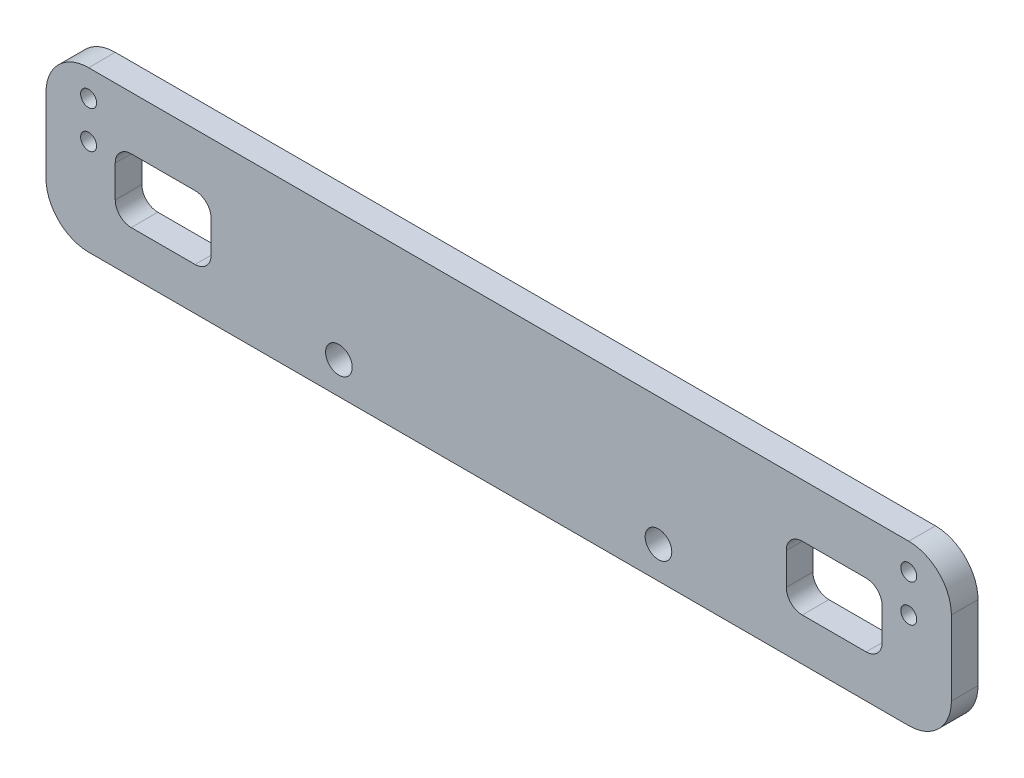
from build123d import *

# Parameters (mm, degrees)
SKETCH_1_W          = 170
SKETCH_1_H          = 60
SKETCH_1_R          = 1.5
EXTRUDE_1_DEPTH     = 5
SKETCH_2_R          = 2.5
CUT_EXTRUDE_1_DEPTH = 5
SKETCH_3_W          = 170
SKETCH_3_H          = 26
CUT_EXTRUDE_2_DEPTH = 10
SKETCH_4_W          = 18
SKETCH_4_H          = 12
CUT_EXTRUDE_3_DEPTH = 10
FILLET_1_R          = 3
SKETCH_5_W          = 170
SKETCH_5_H          = 4
CUT_EXTRUDE_4_DEPTH = 91.277350426
FILLET_2_R          = 8


with BuildPart() as part:
    # 草图1 → 凸台-拉伸1 (new body)
    with BuildSketch(Plane.XY):
        Rectangle(SKETCH_1_W, SKETCH_1_H)
        with Locations((-77, -8)):
            Circle(SKETCH_1_R, mode=Mode.SUBTRACT)
        with Locations((-77, -1)):
            Circle(SKETCH_1_R, mode=Mode.SUBTRACT)
        with Locations(Location((77, -1, 0), (0, 0, 180))):
            Circle(SKETCH_1_R, mode=Mode.SUBTRACT)
        with Locations(Location((77, -8, 0), (0, 0, 180))):
            Circle(SKETCH_1_R, mode=Mode.SUBTRACT)
    extrude(amount=EXTRUDE_1_DEPTH)

    # 草图2 → 切除-拉伸1 (cut)
    with BuildSketch(Plane.XY.offset(5)):
        with Locations((-30, -20)):
            Circle(SKETCH_2_R)
        with Locations((30, -20)):
            Circle(SKETCH_2_R)
    extrude(amount=-CUT_EXTRUDE_1_DEPTH, mode=Mode.SUBTRACT)

    # 草图3 → 切除-拉伸2 (cut)
    with BuildSketch(Plane.XY.offset(5)):
        with Locations((0, 17)):
            Rectangle(SKETCH_3_W, SKETCH_3_H)
    extrude(amount=-CUT_EXTRUDE_2_DEPTH, mode=Mode.SUBTRACT)

    # 草图4 → 切除-拉伸3 (cut)
    with BuildSketch(Plane.XY.offset(5)):
        with Locations((-63, -12)):
            Rectangle(SKETCH_4_W, SKETCH_4_H)
        with Locations((63, -12)):
            Rectangle(SKETCH_4_W, SKETCH_4_H)
    extrude(amount=-CUT_EXTRUDE_3_DEPTH, mode=Mode.SUBTRACT)

    # 圆角1
    fillet_1_edges = [part.edges().sort_by_distance(p)[0] for p in [
        (-72, -18, 2.5),
        (-72, -6, 2.5),
        (-54, -6, 2.5),
        (-54, -18, 2.5),
        (72, -6, 2.5),
        (72, -18, 2.5),
        (54, -18, 2.5),
        (54, -6, 2.5),
    ]]
    fillet(fillet_1_edges, radius=FILLET_1_R)

    # 草图5 → 切除-拉伸4 (cut, through all)
    with BuildSketch(Plane.XY.offset(5)):
        with Locations((0, -28)):
            Rectangle(SKETCH_5_W, SKETCH_5_H)
    extrude(amount=-CUT_EXTRUDE_4_DEPTH, mode=Mode.SUBTRACT)

    # 圆角2
    fillet_2_edges = [part.edges().sort_by_distance(p)[0] for p in [
        (-85, -26, 2.5),
        (85, -26, 2.5),
        (-85, 4, 2.5),
        (85, 4, 2.5),
    ]]
    fillet(fillet_2_edges, radius=FILLET_2_R)


solid = part.part
